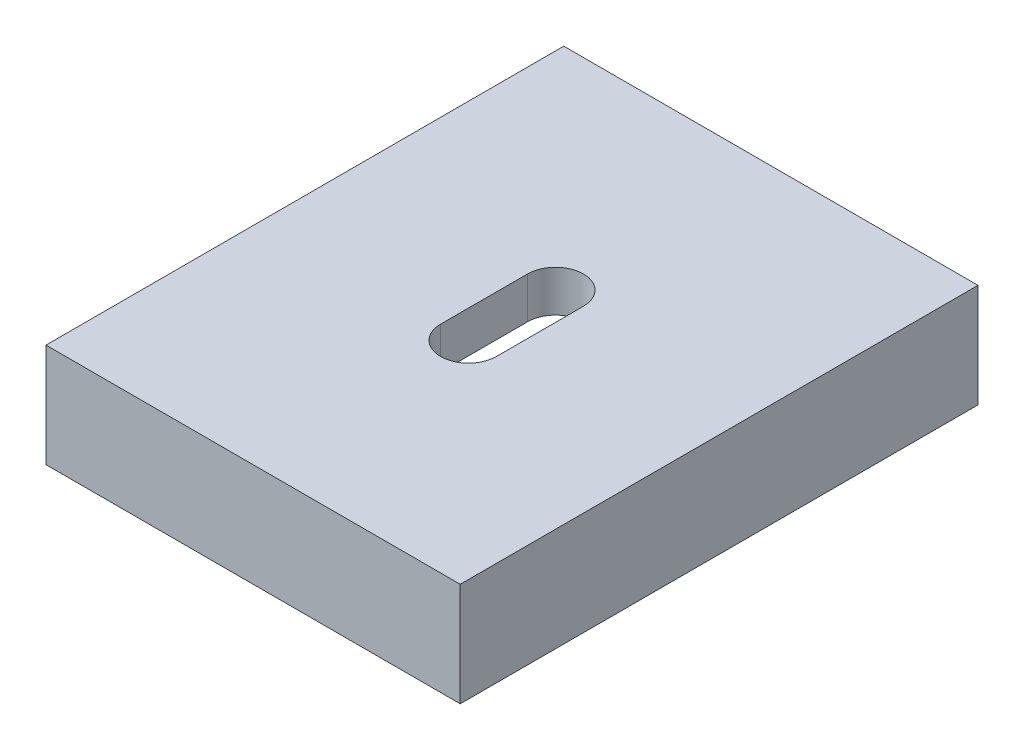
from build123d import *

# Parameters (mm, degrees)
SKETCH_1_W          = 50
SKETCH_1_H          = 40
EXTRUDE_1_DEPTH     = 10
CUT_EXTRUDE_START   = -10
SKETCH_7_W          = 41
SKETCH_7_H          = 26
CUT_EXTRUDE_2_DEPTH = 6
CUT_EXTRUDE_3_DEPTH = 33.57299495


with BuildPart() as part:
    # 草图1 → 凸台-拉伸1 (new body)
    with BuildSketch(Plane(origin=(0, 0, 0), x_dir=(0, 0, -1), z_dir=(0, 1, 0))):
        Rectangle(SKETCH_1_W, SKETCH_1_H)
    extrude(amount=EXTRUDE_1_DEPTH)

    # 草图7 → 切除-拉伸2 (cut)
    with BuildSketch(Plane(origin=(0, 10, 0), x_dir=(0, 0, -1), z_dir=(0, 1, 0)).offset(CUT_EXTRUDE_START)):
        Rectangle(SKETCH_7_W, SKETCH_7_H)
    extrude(amount=CUT_EXTRUDE_2_DEPTH, mode=Mode.SUBTRACT)

    # 草图8 → 切除-拉伸3 (cut, through all)
    with BuildSketch(Plane(origin=(0, 6, 0), x_dir=(0, 0, 1), z_dir=(0, -1, 0))):
        with BuildLine():
            ThreePointArc((-1.5, 0), (-2.290811691, 1.909188309), (-4.2, 2.7))
            Line((-4.2, 2.7), (-4.2, -2.7))
            ThreePointArc((-4.2, -2.7), (-2.290811691, -1.909188309), (-1.5, 0))
        make_face()
        with BuildLine():
            Line((-4.2, -2.7), (-4.2, 2.7))
            ThreePointArc((-4.2, 2.7), (-6.9, 0), (-4.2, -2.7))
        make_face()
        with BuildLine():
            Line((4.2, 2.7), (-4.2, 2.7))
            ThreePointArc((-4.2, 2.7), (-2.290811691, 1.909188309), (-1.5, 0))
            ThreePointArc((-1.5, 0), (-2.290811691, -1.909188309), (-4.2, -2.7))
            Line((-4.2, -2.7), (4.2, -2.7))
            ThreePointArc((4.2, -2.7), (1.5, 0), (4.2, 2.7))
        make_face()
        with BuildLine():
            ThreePointArc((6.9, 0), (6.109188309, 1.909188309), (4.2, 2.7))
            Line((4.2, 2.7), (4.2, -2.7))
            ThreePointArc((4.2, -2.7), (6.109188309, -1.909188309), (6.9, 0))
        make_face()
        with BuildLine():
            Line((4.2, -2.7), (4.2, 2.7))
            ThreePointArc((4.2, 2.7), (1.5, 0), (4.2, -2.7))
        make_face()
    extrude(amount=-CUT_EXTRUDE_3_DEPTH, mode=Mode.SUBTRACT)


solid = part.part
